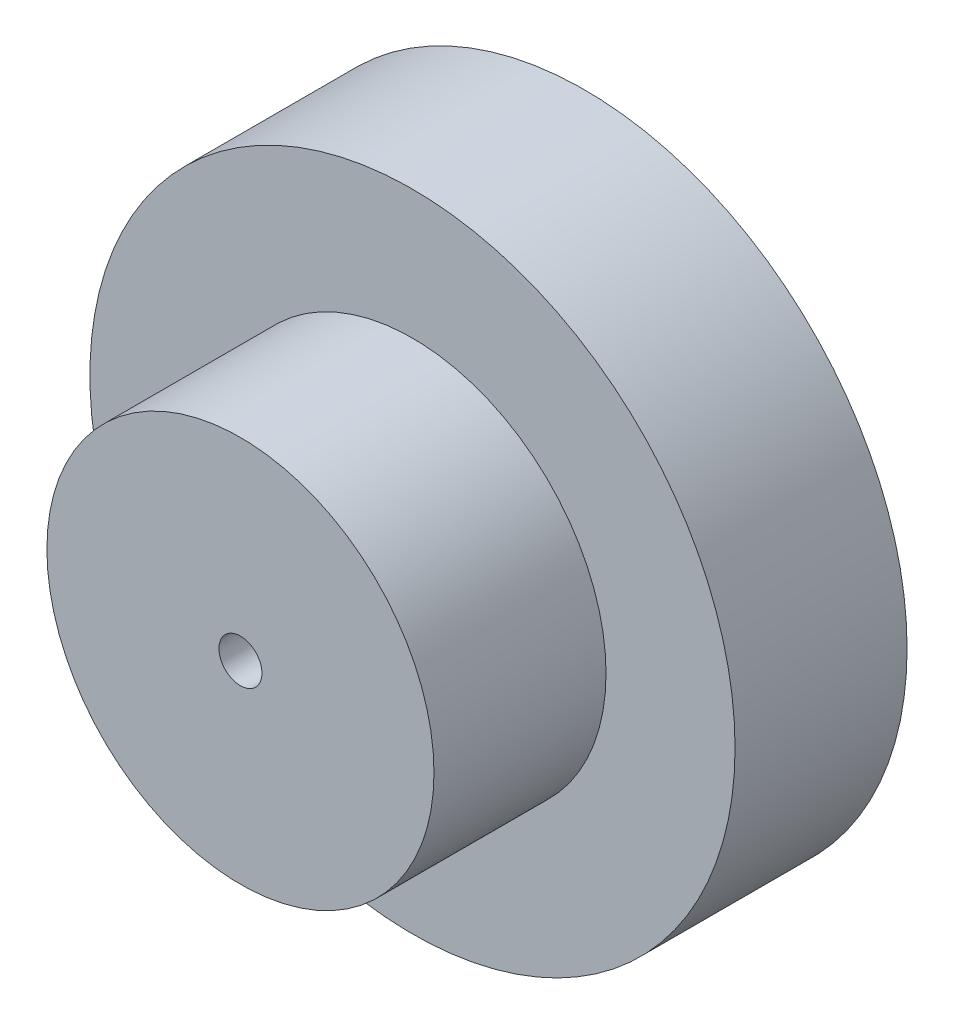
from build123d import *

# Parameters (mm, degrees)
SKETCH_1_R            = 4.5
EXTRUDE_1_DEPTH       = 8
SKETCH_3_R            = 7.5
EXTRUDE_2_DEPTH       = 4
F_1_0MM_1_D           = 1
F_1_0MM_1_CSINK_D     = 6
F_1_0MM_1_CSINK_ANGLE = 90


with BuildPart() as part:
    # 草图1 → 凸台-拉伸1 (new body)
    with BuildSketch(Plane.XY):
        Circle(SKETCH_1_R)
    extrude(amount=EXTRUDE_1_DEPTH)

    # 草图3 → 凸台-拉伸2 (add)
    with BuildSketch(Plane.XY):
        Circle(SKETCH_3_R)
    extrude(amount=EXTRUDE_2_DEPTH)

    # Ø1.0mm 暗销孔1 (through all)
    with Locations(Plane(origin=(0, 0, 0), x_dir=(-1, 0, 0), z_dir=(0, 0, -1))):
        with Locations((0, 0)):
            CounterSinkHole(F_1_0MM_1_D / 2, F_1_0MM_1_CSINK_D / 2, counter_sink_angle=F_1_0MM_1_CSINK_ANGLE)


solid = part.part
